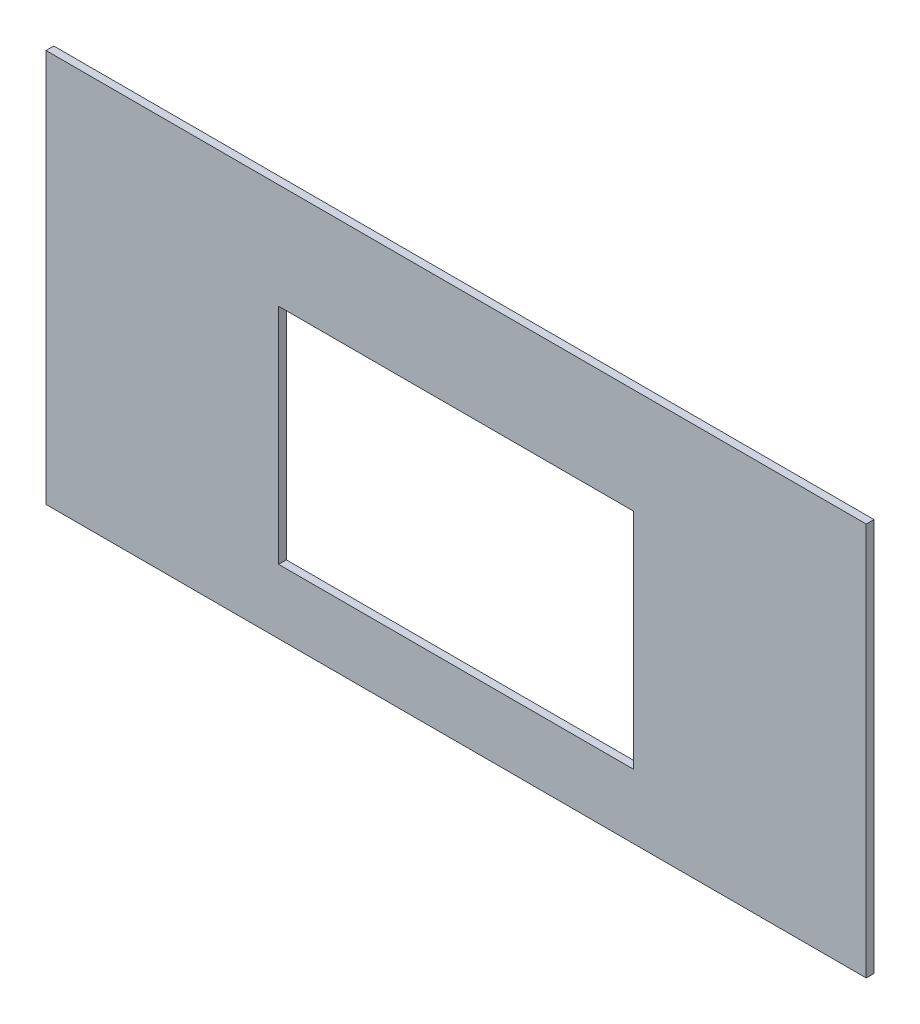
from build123d import *

# Parameters (mm, degrees)
SKETCH1_W           = 62.38
SKETCH1_H           = 29.9
BOSS_EXTRUDE1_DEPTH = 0.59
SKETCH2_W           = 27
SKETCH2_H           = 17
CUT_EXTRUDE1_DEPTH  = 1


with BuildPart() as part:
    # Sketch1 → Boss-Extrude1 (new body)
    with BuildSketch(Plane.XY):
        Rectangle(SKETCH1_W, SKETCH1_H)
    extrude(amount=BOSS_EXTRUDE1_DEPTH)

    # Sketch2 → Cut-Extrude1 (cut)
    with BuildSketch(Plane.XY.offset(0.59)):
        with Locations((0, -1.55)):
            Rectangle(SKETCH2_W, SKETCH2_H)
    extrude(amount=-CUT_EXTRUDE1_DEPTH, mode=Mode.SUBTRACT)


solid = part.part
